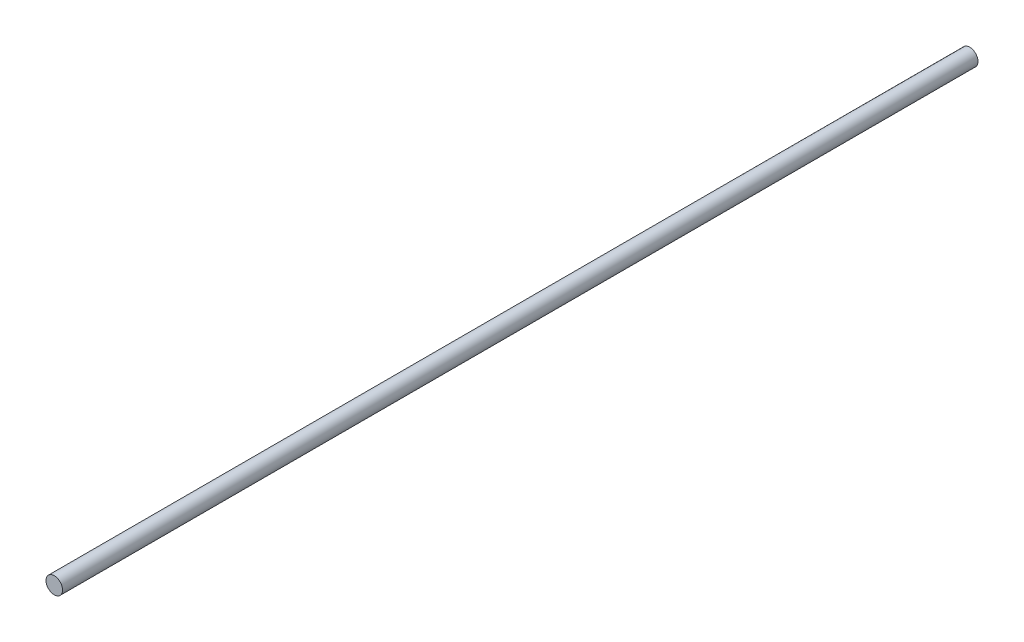
from build123d import *

# Parameters (mm, degrees)
SKETCH1_R           = 50.8
BOSS_EXTRUDE1_DEPTH = 2806.7


with BuildPart() as part:
    # Sketch1 → Boss-Extrude1 (new, symmetric)
    with BuildSketch(Plane.XY):
        Circle(SKETCH1_R)
    extrude(amount=BOSS_EXTRUDE1_DEPTH, both=True)


solid = part.part
